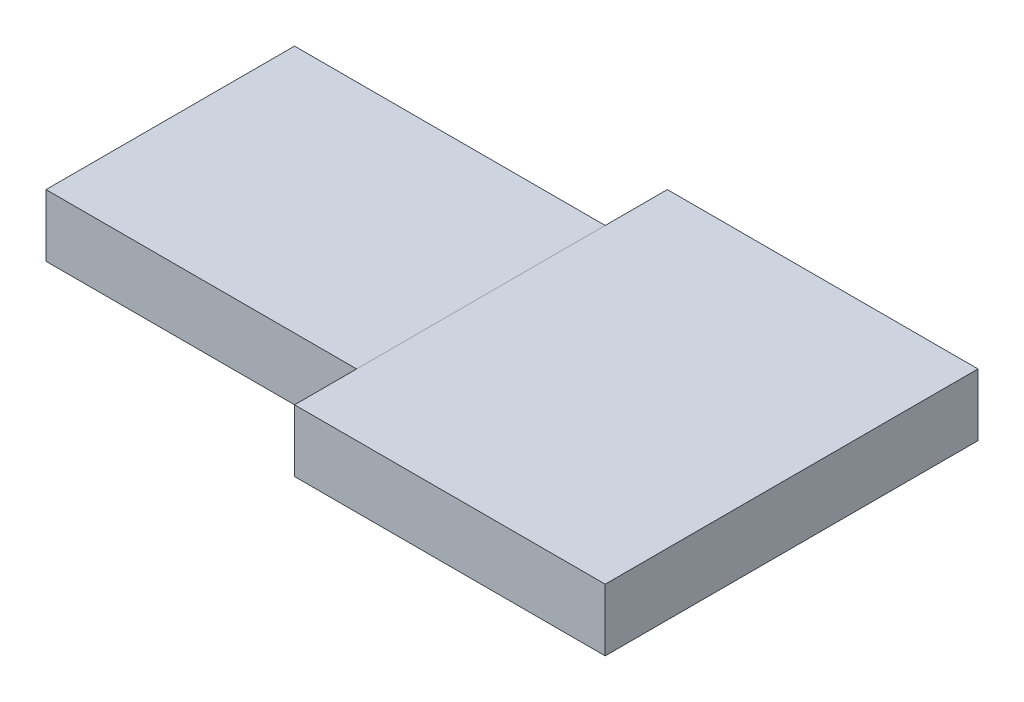
from build123d import *

# Parameters (mm, degrees)
SKETCH1_W           = 100
SKETCH1_H           = 60
BOSS_EXTRUDE1_DEPTH = 5
SKETCH2_W           = 50
SKETCH2_H           = 10
CUT_EXTRUDE1_DEPTH  = 60.160797831
SKETCH3_W           = 50
SKETCH3_H           = 40
CUT_EXTRUDE2_DEPTH  = 0.001


with BuildPart() as part:
    # Sketch1 → Boss-Extrude1 (new, symmetric)
    with BuildSketch(Plane(origin=(0, 0, 0), x_dir=(1, 0, 0), z_dir=(0, 1, 0))):
        Rectangle(SKETCH1_W, SKETCH1_H)
    extrude(amount=BOSS_EXTRUDE1_DEPTH, both=True)

    # Sketch2 → Cut-Extrude1 (cut, through all)
    with BuildSketch(Plane(origin=(0, 5, 0), x_dir=(1, 0, 0), z_dir=(0, 1, 0))):
        with Locations((-25, 25)):
            Rectangle(SKETCH2_W, SKETCH2_H)
        with Locations((-25, -25)):
            Rectangle(SKETCH2_W, SKETCH2_H)
    extrude(amount=-CUT_EXTRUDE1_DEPTH, mode=Mode.SUBTRACT)

    # Sketch3 → Cut-Extrude2 (cut)
    with BuildSketch(Plane(origin=(0, 5, 0), x_dir=(1, 0, 0), z_dir=(0, 1, 0))):
        with Locations((-25, 0)):
            Rectangle(SKETCH3_W, SKETCH3_H)
    cut_extrude2 = extrude(amount=-CUT_EXTRUDE2_DEPTH, mode=Mode.SUBTRACT)

    # Mirror1: Cut-Extrude2 across plane
    add(cut_extrude2.mirror(Plane.ZX), mode=Mode.SUBTRACT)


solid = part.part
